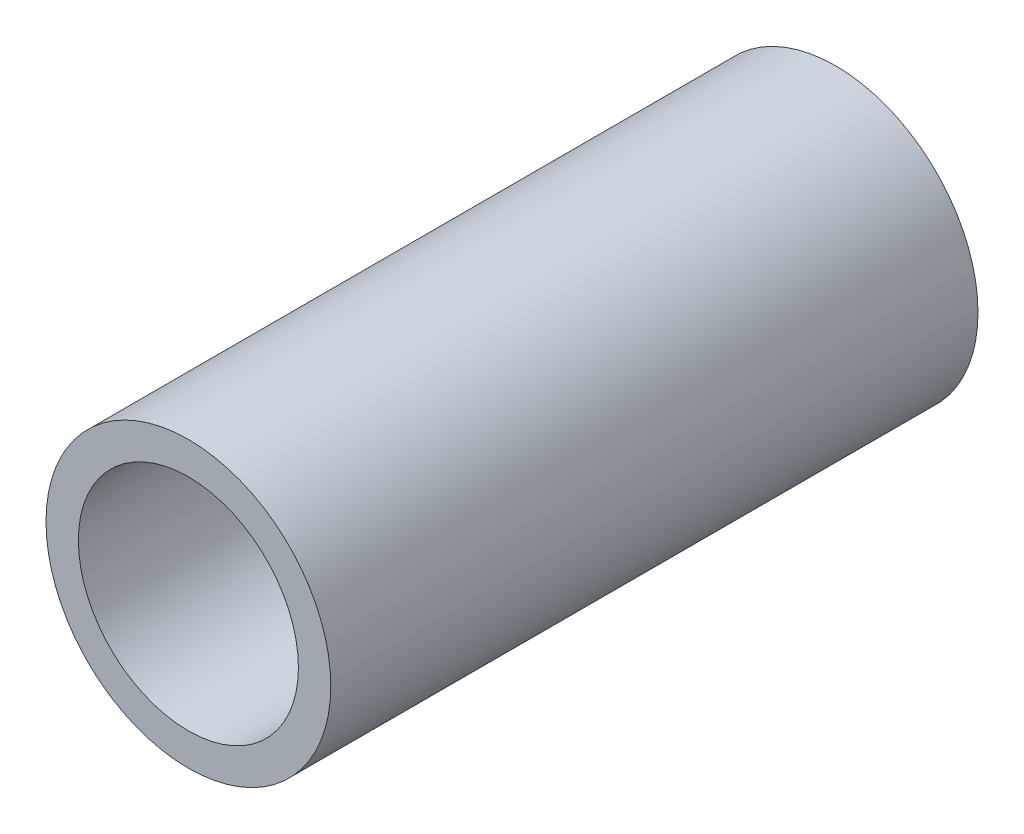
from build123d import *

# Parameters (mm, degrees)
SKETCH1_R           = 2.2
SKETCH1_R_2         = 1.7
BOSS_EXTRUDE1_DEPTH = 10


with BuildPart() as part:
    # Sketch1 → Boss-Extrude1 (new body)
    with BuildSketch(Plane.XY):
        Circle(SKETCH1_R)
        Circle(SKETCH1_R_2, mode=Mode.SUBTRACT)
    extrude(amount=BOSS_EXTRUDE1_DEPTH)


solid = part.part
